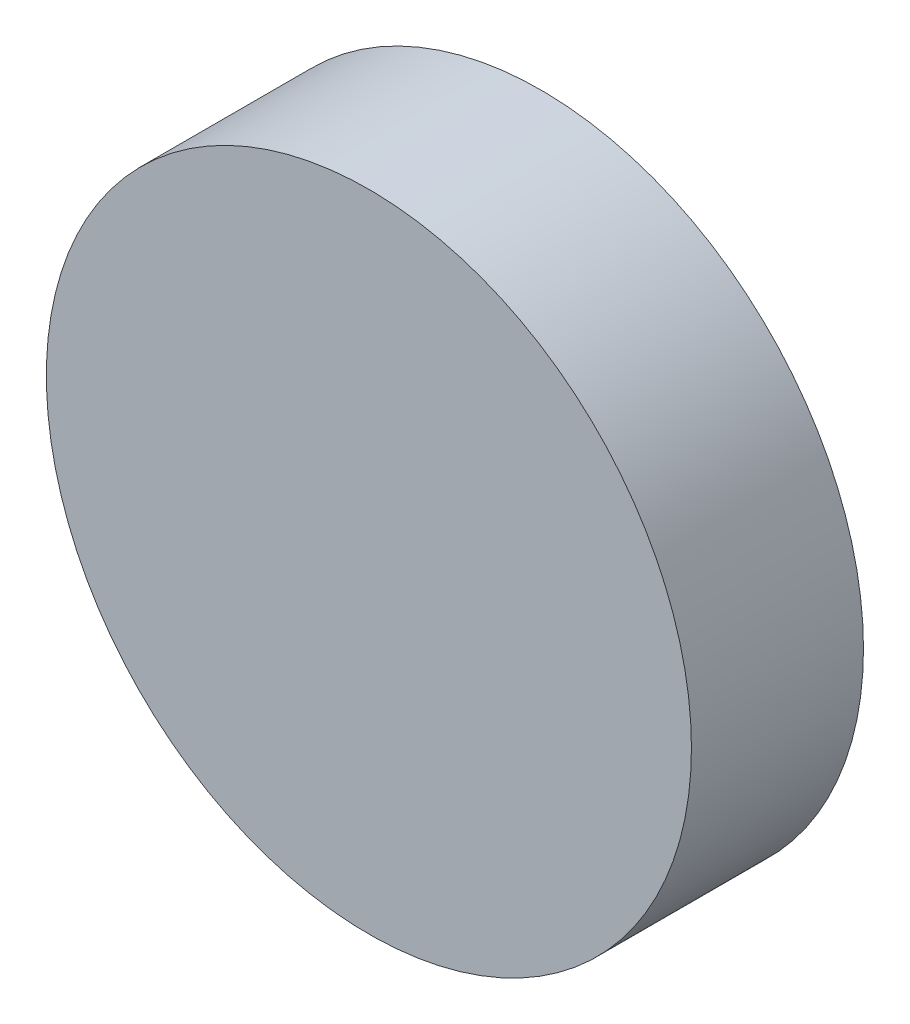
from build123d import *

# Parameters (mm, degrees)
SKETCH1_R           = 37.5
BOSS_EXTRUDE1_DEPTH = 20


with BuildPart() as part:
    # Sketch1 → Boss-Extrude1 (new body)
    with BuildSketch(Plane.XY):
        Circle(SKETCH1_R)
    extrude(amount=BOSS_EXTRUDE1_DEPTH)


solid = part.part
